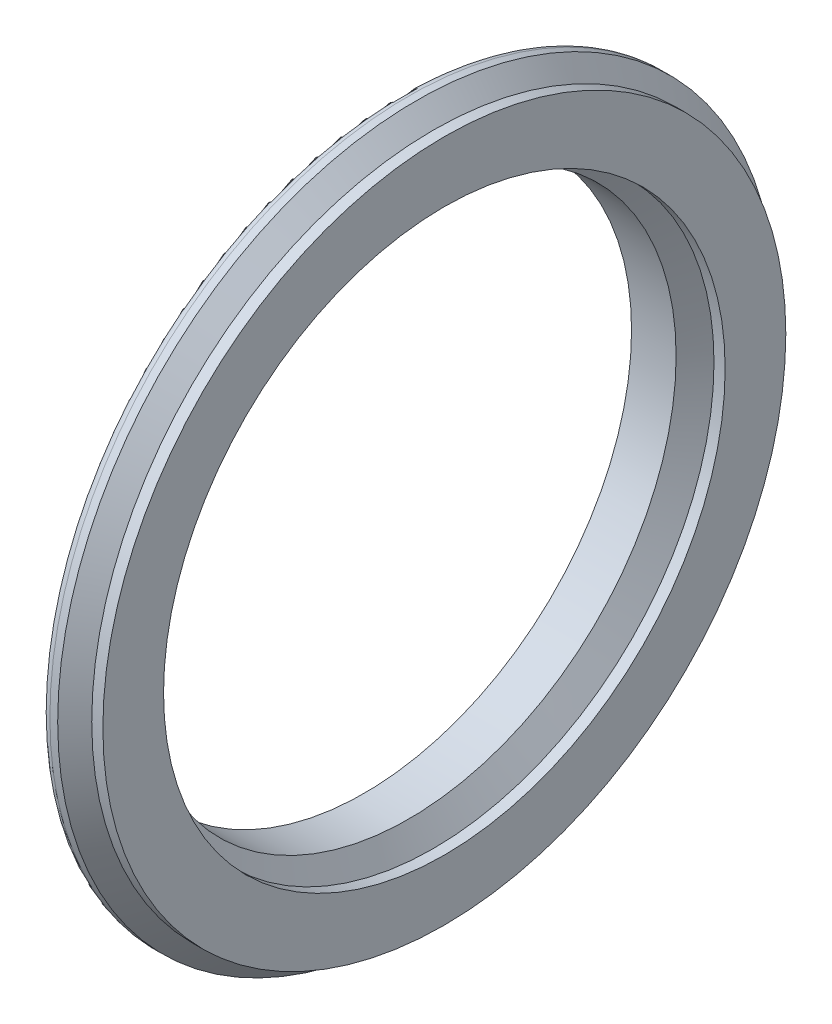
from build123d import *

# Parameters (mm, degrees)
FILLET1_R = 1


with BuildPart() as part:
    # Sketch1 → Revolve1 (revolve)
    with BuildSketch(Plane.XY, mode=Mode.PRIVATE) as revolve1_sk:
        with BuildLine():
            Line((-1.25, 38.305), (-3.125, 40.25))
            Line((-3.125, 40.25), (-5, 40.25))
            Line((-5, 40.25), (-5, 36))
            Line((-5, 36), (-1.25, 36))
            Line((-1.25, 36), (-1.25, 34.59))
            Line((-1.25, 34.59), (-2.48375, 34.59))
            Line((-2.48375, 34.59), (-4.660938533, 32.101784534))
            Line((-4.660938533, 32.101784534), (-5, 33.18))
            Line((-5, 33.18), (-9, 33.18))
            Line((-9, 33.18), (-9, 30))
            Line((-9, 30), (-4, 30))
            Line((-4, 30), (-1.342891128, 34.434956263))
            ThreePointArc((-1.342891128, 34.434956263), (-1.286668766, 34.457448986), (-1.25, 34.409258964))
            Line((-1.25, 34.409258964), (-1.25, 31.5))
            Line((-1.25, 31.5), (0, 31.5))
            Line((0, 31.5), (0, 38.305))
            Line((0, 38.305), (-1.25, 38.305))
        make_face()
    revolve(revolve1_sk.sketch.rotate(Axis((-9, 0, 0), (1, 0, 0)), 270), axis=Axis((-9, 0, 0), (1, 0, 0)))

    # Fillet1
    fillet1_edges = [part.edges().sort_by_distance(p)[0] for p in [
        (-5, 0, 40.25),
    ]]
    fillet(fillet1_edges, radius=FILLET1_R)


solid = part.part
